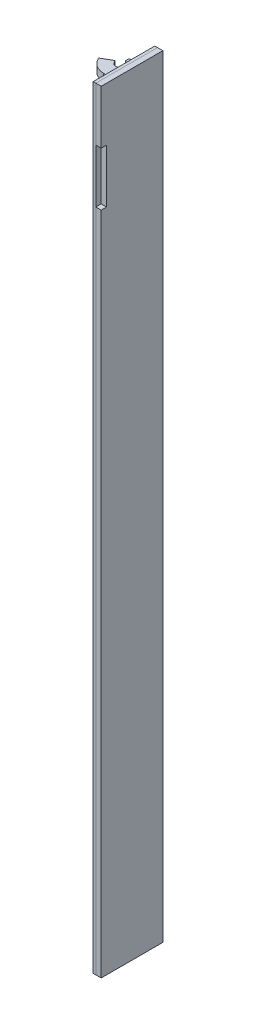
from build123d import *

# Parameters (mm, degrees)
SKETCH1_W             = 288
SKETCH1_H             = 23
BOSS_EXTRUDE1_DEPTH   = 1
BOSS_EXTRUDE5_START   = 1
SKETCH1_2_W           = 288
SKETCH1_2_H           = 23
BOSS_EXTRUDE5_DEPTH   = 2
BOSS_EXTRUDE2_DEPTH   = 2.8
BOSS_EXTRUDE3_START   = -270.5
BOSS_EXTRUDE3_DEPTH   = 2.8
CUT_EXTRUDE1_START    = -2
CUT_EXTRUDE1_DEPTH    = 1
BOSS_EXTRUDE4_START   = -2
BOSS_EXTRUDE4_DEPTH   = 1
BOSS_EXTRUDE4_2_DEPTH = 1
BOSS_EXTRUDE4_3_DEPTH = 1
BOSS_EXTRUDE4_4_DEPTH = 1
BOSS_EXTRUDE4_5_DEPTH = 1
BOSS_EXTRUDE4_6_DEPTH = 1
BOSS_EXTRUDE4_7_DEPTH = 1
BOSS_EXTRUDE4_8_DEPTH = 1
SKETCH6_W             = 20
SKETCH6_H             = 2
CUT_EXTRUDE2_DEPTH    = 2


with BuildPart() as part:
    # Sketch1 → Boss-Extrude1 (new body)
    with BuildSketch(Plane.YZ):
        Rectangle(SKETCH1_W, SKETCH1_H)
    extrude(amount=BOSS_EXTRUDE1_DEPTH)

    # Sketch3 → Boss-Extrude2 (add)
    with BuildSketch(Plane(origin=(0, 136.65, 0), x_dir=(0, 0, -1), z_dir=(0, 1, 0))):
        with BuildLine():
            Line((8.734313483, 8.05), (9.75, 8.05))
            ThreePointArc((9.75, 8.05), (9.926776695, 7.976776695), (10, 7.8))
            Line((10, 7.8), (10, 1.707106781))
            ThreePointArc((10, 1.707106781), (10.038060234, 1.515765065), (10.146446609, 1.353553391))
            Line((10.146446609, 1.353553391), (11.5, 0))
            Line((11.5, 0), (0.5, 0))
            Line((0.5, 0), (0.5, 4.56))
            ThreePointArc((0.5, 4.56), (0.458994949, 4.658994949), (0.36, 4.7))
            Line((0.36, 4.7), (0.14, 4.7))
            ThreePointArc((0.14, 4.7), (0.041005051, 4.741005051), (0, 4.84))
            Line((0, 4.84), (0, 7.56))
            ThreePointArc((0, 7.56), (0.041005051, 7.658994949), (0.14, 7.7))
            Line((0.14, 7.7), (0.36, 7.7))
            ThreePointArc((0.36, 7.7), (0.458994949, 7.741005051), (0.5, 7.84))
            Line((0.5, 7.84), (0.5, 8.05))
            ThreePointArc((0.5, 8.05), (1.337341226, 11.175), (3.625, 13.462658774))
            Line((3.625, 13.462658774), (4.274519053, 13.837658774))
            ThreePointArc((4.274519053, 13.837658774), (4.464223814, 13.862633879), (4.616025404, 13.746152423))
            Line((4.616025404, 13.746152423), (6.616025404, 10.282050808))
            ThreePointArc((6.616025404, 10.282050808), (6.641000509, 10.092346046), (6.524519053, 9.940544457))
            Line((6.524519053, 9.940544457), (5.875, 9.565544457))
            ThreePointArc((5.875, 9.565544457), (5.78180959, 6.592225213), (8.486274298, 7.83125))
            ThreePointArc((8.486274298, 7.83125), (8.568954026, 7.9875), (8.734313483, 8.05))
        make_face()
    extrude(amount=-BOSS_EXTRUDE2_DEPTH)

    # Sketch3<2> → Boss-Extrude3 (add)
    with BuildSketch(Plane(origin=(0, 136.65, 0), x_dir=(0, 0, -1), z_dir=(0, 1, 0)).offset(BOSS_EXTRUDE3_START)):
        with BuildLine():
            Line((8.734313483, 8.05), (9.75, 8.05))
            ThreePointArc((9.75, 8.05), (9.926776695, 7.976776695), (10, 7.8))
            Line((10, 7.8), (10, 1.707106781))
            ThreePointArc((10, 1.707106781), (10.038060234, 1.515765065), (10.146446609, 1.353553391))
            Line((10.146446609, 1.353553391), (11.5, 0))
            Line((11.5, 0), (0.5, 0))
            Line((0.5, 0), (0.5, 4.56))
            ThreePointArc((0.5, 4.56), (0.458994949, 4.658994949), (0.36, 4.7))
            Line((0.36, 4.7), (0.14, 4.7))
            ThreePointArc((0.14, 4.7), (0.041005051, 4.741005051), (0, 4.84))
            Line((0, 4.84), (0, 7.56))
            ThreePointArc((0, 7.56), (0.041005051, 7.658994949), (0.14, 7.7))
            Line((0.14, 7.7), (0.36, 7.7))
            ThreePointArc((0.36, 7.7), (0.458994949, 7.741005051), (0.5, 7.84))
            Line((0.5, 7.84), (0.5, 8.05))
            ThreePointArc((0.5, 8.05), (1.337341226, 11.175), (3.625, 13.462658774))
            Line((3.625, 13.462658774), (4.274519053, 13.837658774))
            ThreePointArc((4.274519053, 13.837658774), (4.464223814, 13.862633879), (4.616025404, 13.746152423))
            Line((4.616025404, 13.746152423), (6.616025404, 10.282050808))
            ThreePointArc((6.616025404, 10.282050808), (6.641000509, 10.092346046), (6.524519053, 9.940544457))
            Line((6.524519053, 9.940544457), (5.875, 9.565544457))
            ThreePointArc((5.875, 9.565544457), (5.78180959, 6.592225213), (8.486274298, 7.83125))
            ThreePointArc((8.486274298, 7.83125), (8.568954026, 7.9875), (8.734313483, 8.05))
        make_face()
    extrude(amount=-BOSS_EXTRUDE3_DEPTH)


with BuildPart() as body_2:
    # Sketch1<2> → Boss-Extrude5 (new body)
    with BuildSketch(Plane.YZ.offset(BOSS_EXTRUDE5_START)):
        Rectangle(SKETCH1_2_W, SKETCH1_2_H)
    extrude(amount=BOSS_EXTRUDE5_DEPTH)

    # Sketch4 → Cut-Extrude1 (cut)
    # profile 1 of 8: a face of its own
    with BuildSketch(Plane.YZ.offset(3).offset(CUT_EXTRUDE1_START)):
        Polygon((105.894557407, 6.823226802), (108.394557407, 4.323226802), (110.894557407, 6.823226802), align=None)
    # profile 2 of 8: a face of its own
    with BuildSketch(Plane.YZ.offset(3).offset(CUT_EXTRUDE1_START)):
        Polygon((-30, -5), (-29, -5), (-29, -0.5), (-10, -0.5), (-10, 5), (-30, 5), (-30, 4), (-11, 4), (-11, 0.5), (-30, 0.5), align=None)
    # profile 3 of 8: a face of its own
    with BuildSketch(Plane.YZ.offset(3).offset(CUT_EXTRUDE1_START)):
        Polygon((10, 5), (10, 4), (0.5, 4), (0.5, -5), (-10, -5), (-10, -4), (-0.5, -4), (-0.5, 5), align=None)
    # profile 4 of 8: a face of its own
    with BuildSketch(Plane.YZ.offset(3).offset(CUT_EXTRUDE1_START)):
        Polygon((29.945625464, 5), (32, 5), (23.027187268, 0), (32, -5), (29.945625464, -5), (22, -0.572388669), (14.054374536, -5), (12, -5), (20.972812732, 0), (12, 5), (14.054374536, 5), (22, 0.572388669), align=None)
    # profile 5 of 8: a face of its own
    with BuildSketch(Plane.YZ.offset(3).offset(CUT_EXTRUDE1_START)):
        with BuildLine():
            add(Edge.make_bspline(
                [(112.554813818, 5.558202763), (112.554990732, 5.589096731), (112.55533817, 5.649768497), (112.561358461, 5.738776255), (112.569293673, 5.824093515), (112.582216154, 5.905384691), (112.597417709, 5.983030256), (112.61643082, 6.05700716), (112.639334885, 6.127055969), (112.657555251, 6.171781377), (112.666492503, 6.19371959)],
                knots=[0, 0, 0, 0, 1.141009212, 2.240794809, 3.294380675, 4.305229195, 5.280013876, 6.216333343, 7.125095522, 8, 8, 8, 8], degree=3))
            add(Edge.make_bspline(
                [(112.666492503, 6.19371959), (112.68110152, 6.224907301), (112.710147726, 6.286915905), (112.764091096, 6.374539047), (112.825232726, 6.45717477), (112.893069253, 6.534389863), (112.965868789, 6.605021896), (113.043974769, 6.665472746), (113.124612321, 6.717783967), (113.181963928, 6.744093402), (113.210362696, 6.757121032)],
                knots=[0, 0, 0, 0, 1.031372299, 2.050613973, 3.077158538, 4.108712802, 5.127684358, 6.111366908, 7.06480644, 8, 8, 8, 8], degree=3))
            add(Edge.make_bspline(
                [(113.210362696, 6.757121032), (113.229639673, 6.765028018), (113.268603359, 6.781010053), (113.329157514, 6.80095647), (113.392009265, 6.817162032), (113.456704009, 6.831647916), (113.523869878, 6.84163641), (113.592964144, 6.850011419), (113.664364936, 6.854400907), (113.712661337, 6.854982511), (113.737205644, 6.855278084)],
                knots=[0, 0, 0, 0, 0.92659354, 1.872881803, 2.832850937, 3.813025581, 4.820167273, 5.851730198, 6.908245912, 8, 8, 8, 8], degree=3))
            add(Edge.make_bspline(
                [(113.737205644, 6.855278084), (113.781154127, 6.854176439), (113.867161911, 6.852020507), (113.992795131, 6.836448461), (114.111682302, 6.810153628), (114.22342099, 6.772147848), (114.32897457, 6.724639799), (114.427522955, 6.665711474), (114.519211997, 6.596000657), (114.603864605, 6.516463308), (114.680100341, 6.427238041), (114.746495334, 6.329158352), (114.802191757, 6.222683852), (114.848060977, 6.108108309), (114.883308016, 5.985057484), (114.908773969, 5.853878576), (114.923902807, 5.714474961), (114.925690551, 5.618837906), (114.926608689, 5.569721193)],
                knots=[0, 0, 0, 0, 1.064641025, 2.083517118, 3.061799897, 4.009540929, 4.938075217, 5.861300345, 6.78508344, 7.723570974, 8.670267188, 9.622657076, 10.586935816, 11.576069104, 12.607749008, 13.683335114, 14.81022093, 16, 16, 16, 16], degree=3))
            add(Edge.make_bspline(
                [(114.926608689, 5.569721193), (114.925711757, 5.520933371), (114.923965597, 5.425952598), (114.90855437, 5.287642889), (114.884144198, 5.157420279), (114.848044321, 5.035582243), (114.803544104, 4.921199076), (114.747274551, 4.815633172), (114.68227007, 4.71748427), (114.606142612, 4.629220475), (114.522914756, 4.549226661), (114.431342017, 4.480330588), (114.333511016, 4.421322418), (114.228532933, 4.373677078), (114.117091997, 4.336454014), (113.998824527, 4.309957124), (113.873669866, 4.294445002), (113.787997195, 4.292281241), (113.744216862, 4.291175519)],
                knots=[0, 0, 0, 0, 1.18845052, 2.313691126, 3.386664782, 4.412527756, 5.405809582, 6.372003093, 7.321919452, 8.268293321, 9.206237639, 10.129603466, 11.054616372, 11.9847576, 12.932764752, 13.912672021, 14.933336461, 16, 16, 16, 16], degree=3))
            add(Edge.make_bspline(
                [(113.744216862, 4.291175519), (113.699936443, 4.292283793), (113.613266942, 4.294453003), (113.48677739, 4.309917908), (113.367335914, 4.336423519), (113.255027566, 4.373777516), (113.149086384, 4.420699065), (113.05049048, 4.479104257), (112.959185354, 4.548436661), (112.875262081, 4.627488878), (112.799181696, 4.715493176), (112.734269512, 4.813011008), (112.677997024, 4.917545797), (112.633262848, 5.030680993), (112.59736176, 5.151252582), (112.572891939, 5.279954341), (112.557450912, 5.416432049), (112.555708916, 5.510082095), (112.554813818, 5.558202763)],
                knots=[0, 0, 0, 0, 1.080878253, 2.11558926, 3.1052859, 4.062802436, 5.000434901, 5.928596448, 6.853693179, 7.793554778, 8.738606028, 9.68692032, 10.647726704, 11.63151566, 12.651483354, 13.714466703, 14.825613081, 16, 16, 16, 16], degree=3))
        make_face()
        with BuildLine():
            add(Edge.make_bspline(
                [(113.035583048, 5.574729205), (113.036063331, 5.540147601), (113.036993389, 5.473180981), (113.046899736, 5.375980553), (113.061933415, 5.285111785), (113.084042648, 5.200677811), (113.111973456, 5.122617548), (113.146194486, 5.0508657), (113.186564315, 4.985315401), (113.234127113, 4.927350509), (113.285586331, 4.875599034), (113.341131965, 4.830820956), (113.399728842, 4.792280191), (113.462390863, 4.761852387), (113.527813922, 4.737704596), (113.596506309, 4.719799893), (113.668809579, 4.709968453), (113.718147323, 4.708558544), (113.74321526, 4.707842186)],
                knots=[0, 0, 0, 0, 1.313550922, 2.543666373, 3.708465049, 4.810029406, 5.85539231, 6.85404609, 7.825601258, 8.772642133, 9.696587791, 10.59409323, 11.479048685, 12.35559886, 13.234601248, 14.125357077, 15.047515647, 16, 16, 16, 16], degree=3))
            add(Edge.make_bspline(
                [(113.74321526, 4.707842186), (113.768286573, 4.70854403), (113.817630965, 4.709925372), (113.889845396, 4.719957829), (113.958673913, 4.737095098), (114.023837065, 4.761119146), (114.085631857, 4.792030106), (114.144004465, 4.829706868), (114.198618415, 4.874688667), (114.25002162, 4.925688322), (114.296300583, 4.984038211), (114.336326697, 5.049577198), (114.370530866, 5.121764223), (114.398464615, 5.20062629), (114.420029736, 5.286311777), (114.434449853, 5.378866021), (114.444436308, 5.478024381), (114.445362572, 5.546490653), (114.445839459, 5.581740423)],
                knots=[0, 0, 0, 0, 0.949153107, 1.868086493, 2.754172764, 3.630100905, 4.492260106, 5.365378617, 6.254840125, 7.166615376, 8.102436631, 9.067266169, 10.06813181, 11.121736829, 12.23011542, 13.408501285, 14.665770308, 16, 16, 16, 16], degree=3))
            add(Edge.make_bspline(
                [(114.445839459, 5.581740423), (114.44530081, 5.616649838), (114.444257665, 5.684255236), (114.435172951, 5.782161815), (114.420293868, 5.87324887), (114.399610299, 5.957492804), (114.372275663, 6.034907192), (114.339627639, 6.105703732), (114.300151541, 6.169512551), (114.254877294, 6.226300609), (114.204779255, 6.276285049), (114.150708572, 6.320044285), (114.092358036, 6.35645463), (114.030297137, 6.387088995), (113.963879758, 6.409816518), (113.893780854, 6.426393783), (113.819802051, 6.436602087), (113.769122873, 6.437931705), (113.74321526, 6.438611417)],
                knots=[0, 0, 0, 0, 1.332337092, 2.580197383, 3.749299508, 4.852775005, 5.886662144, 6.878700295, 7.822989687, 8.743523536, 9.644687758, 10.519443927, 11.392806431, 12.264866173, 13.155606721, 14.065961015, 15.011303331, 16, 16, 16, 16], degree=3))
            add(Edge.make_bspline(
                [(113.74321526, 6.438611417), (113.717304372, 6.437942161), (113.666618789, 6.436632995), (113.592524669, 6.426255677), (113.522204931, 6.410172373), (113.45579694, 6.386147105), (113.393195471, 6.355806927), (113.334632071, 6.318179059), (113.279645279, 6.274494086), (113.229098375, 6.223751767), (113.183090543, 6.166466423), (113.143595434, 6.101877926), (113.109917177, 6.030691662), (113.08228612, 5.952696913), (113.061802962, 5.867679121), (113.04605995, 5.776209658), (113.037219258, 5.677734895), (113.036140174, 5.609802391), (113.035583048, 5.574729205)],
                knots=[0, 0, 0, 0, 0.981996942, 1.920933313, 2.83127778, 3.712125466, 4.592427284, 5.463259035, 6.34592384, 7.249932058, 8.173122297, 9.125107726, 10.113123258, 11.154048744, 12.256187849, 13.424658091, 14.670364834, 16, 16, 16, 16], degree=3))
        make_face(mode=Mode.SUBTRACT)
    # profile 6 of 8: a face of its own
    with BuildSketch(Plane.YZ.offset(3).offset(CUT_EXTRUDE1_START)):
        with BuildLine():
            Line((115.343275356, 4.323226802), (115.343275356, 6.823226802))
            Line((115.343275356, 6.823226802), (116.143055003, 6.823226802))
            add(Edge.make_bspline(
                [(116.143055003, 6.823226802), (116.179280814, 6.823187241), (116.248566982, 6.823111577), (116.34739951, 6.821009321), (116.436383396, 6.818033345), (116.515386571, 6.814326893), (116.584687028, 6.808796155), (116.643973893, 6.802391643), (116.693620491, 6.795502088), (116.722855902, 6.78837232), (116.736003721, 6.785165904)],
                knots=[0, 0, 0, 0, 1.460485487, 2.793352117, 3.985295279, 5.050041172, 5.981765236, 6.787433016, 7.454681457, 8, 8, 8, 8], degree=3))
            add(Edge.make_bspline(
                [(116.736003721, 6.785165904), (116.753487124, 6.780180712), (116.788187582, 6.770286275), (116.837902517, 6.749192905), (116.885819842, 6.724746815), (116.931337528, 6.695611494), (116.974610302, 6.662304198), (117.015766792, 6.625096551), (117.055026479, 6.583820591), (117.091846256, 6.538557856), (117.12556884, 6.489536583), (117.154713625, 6.436684297), (117.179130862, 6.38023072), (117.199933942, 6.320600094), (117.215282553, 6.257153081), (117.226023791, 6.19033052), (117.233501032, 6.120103182), (117.234030444, 6.07204532), (117.234300997, 6.047485616)],
                knots=[0, 0, 0, 0, 0.907145743, 1.80047177, 2.69161667, 3.591261238, 4.495029544, 5.415863088, 6.359363025, 7.337192411, 8.326890979, 9.326929023, 10.346104993, 11.395420813, 12.477187422, 13.601053412, 14.774031606, 16, 16, 16, 16], degree=3))
            add(Edge.make_bspline(
                [(117.234300997, 6.047485616), (117.233529381, 6.010188912), (117.232043979, 5.938390709), (117.215424958, 5.835459283), (117.190076864, 5.74143806), (117.153028793, 5.657232661), (117.107859498, 5.58251265), (117.05810459, 5.515152912), (117.001291797, 5.45718374), (116.939910585, 5.407669616), (116.875041863, 5.367149311), (116.810055715, 5.332606326), (116.744075248, 5.306048576), (116.699089913, 5.294477151), (116.67690917, 5.288771673)],
                knots=[0, 0, 0, 0, 1.312386234, 2.526415563, 3.661883817, 4.733421185, 5.753802465, 6.732107337, 7.675884281, 8.604170108, 9.50284679, 10.365392406, 11.194030444, 12, 12, 12, 12], degree=3))
            add(Edge.make_bspline(
                [(116.67690917, 5.288771673), (116.661077644, 5.285760145), (116.627706675, 5.279412202), (116.574782315, 5.273084459), (116.516933121, 5.266080337), (116.453921156, 5.261511855), (116.385822647, 5.257233664), (116.312664038, 5.255213788), (116.23454988, 5.252780248), (116.180784444, 5.25273652), (116.153071029, 5.252713981)],
                knots=[0, 0, 0, 0, 0.735353946, 1.55003838, 2.431865514, 3.394945452, 4.432993119, 5.54609699, 6.735134699, 8, 8, 8, 8], degree=3))
            Line((116.153071029, 5.252713981), (115.824044587, 5.252713981))
            Line((115.824044587, 5.252713981), (115.824044587, 4.323226802))
            Line((115.824044587, 4.323226802), (115.343275356, 4.323226802))
        make_face()
        with BuildLine():
            Line((115.824044587, 6.406560135), (115.824044587, 5.669380648))
            Line((115.824044587, 5.669380648), (116.112506125, 5.669380648))
            add(Edge.make_bspline(
                [(116.112506125, 5.669380648), (116.13738144, 5.669412859), (116.184971048, 5.669474484), (116.253251578, 5.671686443), (116.315059178, 5.674386549), (116.370522994, 5.678855777), (116.419308231, 5.684746113), (116.461741591, 5.691791696), (116.497872531, 5.699352344), (116.536943223, 5.711881548), (116.578717605, 5.732152657), (116.623327735, 5.761287334), (116.662517681, 5.796121275), (116.695128911, 5.837032533), (116.721178064, 5.882487311), (116.739829276, 5.932019773), (116.751872347, 5.984808994), (116.752972371, 6.021377456), (116.753531766, 6.039973596)],
                knots=[0, 0, 0, 0, 1.411705958, 2.700771114, 3.876961699, 4.922619712, 5.858038221, 6.66485904, 7.363650596, 7.950905807, 8.989198271, 9.987739806, 10.967313358, 11.951275539, 12.944273208, 13.927870418, 14.946261014, 16, 16, 16, 16], degree=3))
            add(Edge.make_bspline(
                [(116.753531766, 6.039973596), (116.752744479, 6.062623406), (116.751218033, 6.106538399), (116.734385597, 6.169080679), (116.708415071, 6.225838556), (116.671284592, 6.275046037), (116.626431847, 6.316425482), (116.576019233, 6.350854651), (116.518970167, 6.374948446), (116.47859472, 6.384283902), (116.45805901, 6.38903209)],
                knots=[0, 0, 0, 0, 1.085904563, 2.105425768, 3.088705091, 4.068969419, 5.045188284, 6.010769642, 6.988240112, 8, 8, 8, 8], degree=3))
            add(Edge.make_bspline(
                [(116.45805901, 6.38903209), (116.449222025, 6.390445494), (116.429606657, 6.393582812), (116.397001924, 6.396856993), (116.358430521, 6.399834858), (116.313845951, 6.402279774), (116.263424939, 6.404191132), (116.207001173, 6.405865954), (116.144723254, 6.406000503), (116.101154222, 6.406368423), (116.078451638, 6.406560135)],
                knots=[0, 0, 0, 0, 0.564603001, 1.253243608, 2.066786758, 3.005752288, 4.070476343, 5.250658742, 6.567396469, 8, 8, 8, 8], degree=3))
            Line((116.078451638, 6.406560135), (115.824044587, 6.406560135))
        make_face(mode=Mode.SUBTRACT)
    # profile 7 of 8: a face of its own
    with BuildSketch(Plane.YZ.offset(3).offset(CUT_EXTRUDE1_START)):
        Polygon((117.650967664, 4.323226802), (117.650967664, 6.823226802), (119.509942023, 6.823226802), (119.509942023, 6.406560135), (118.131736894, 6.406560135), (118.131736894, 5.86168834), (119.413788176, 5.86168834), (119.413788176, 5.445021673), (118.131736894, 5.445021673), (118.131736894, 4.739893468), (119.541993305, 4.739893468), (119.541993305, 4.323226802), align=None)
    # profile 8 of 8: a face of its own
    with BuildSketch(Plane.YZ.offset(3).offset(CUT_EXTRUDE1_START)):
        Polygon((119.958659971, 4.323226802), (119.958659971, 6.823226802), (120.460963657, 6.823226802), (121.465070228, 5.179596994), (121.465070228, 6.823226802), (121.945839459, 6.823226802), (121.945839459, 4.323226802), (121.428010933, 4.323226802), (120.439429202, 5.940814943), (120.439429202, 4.323226802), align=None)
    extrude(amount=CUT_EXTRUDE1_DEPTH, mode=Mode.SUBTRACT)

    # Sketch6 → Cut-Extrude2 (cut)
    with BuildSketch(Plane.YZ.offset(3)):
        with Locations((114, 10.5)):
            Rectangle(SKETCH6_W, SKETCH6_H)
    extrude(amount=-CUT_EXTRUDE2_DEPTH, mode=Mode.SUBTRACT)


with BuildPart() as body_3:
    # Sketch4<2> → Boss-Extrude4 (new body)
    with BuildSketch(Plane.YZ.offset(3).offset(BOSS_EXTRUDE4_START)):
        Polygon((110.894557407, 6.823226802), (105.894557407, 6.823226802), (108.394557407, 4.323226802), align=None)
    extrude(amount=BOSS_EXTRUDE4_DEPTH)


with BuildPart() as body_4:
    # Sketch4<2> → Boss-Extrude4 2 (new body)
    with BuildSketch(Plane.YZ.offset(3).offset(BOSS_EXTRUDE4_START)):
        Polygon((-30, 0.5), (-30, -5), (-29, -5), (-29, -0.5), (-10, -0.5), (-10, 5), (-30, 5), (-30, 4), (-11, 4), (-11, 0.5), align=None)
    extrude(amount=BOSS_EXTRUDE4_2_DEPTH)


with BuildPart() as body_5:
    # Sketch4<2> → Boss-Extrude4 3 (new body)
    with BuildSketch(Plane.YZ.offset(3).offset(BOSS_EXTRUDE4_START)):
        Polygon((10, 4), (10, 5), (-0.5, 5), (-0.5, -4), (-10, -4), (-10, -5), (0.5, -5), (0.5, 4), align=None)
    extrude(amount=BOSS_EXTRUDE4_3_DEPTH)


with BuildPart() as body_6:
    # Sketch4<2> → Boss-Extrude4 4 (new body)
    with BuildSketch(Plane.YZ.offset(3).offset(BOSS_EXTRUDE4_START)):
        Polygon((32, 5), (29.945625464, 5), (22, 0.572388669), (14.054374536, 5), (12, 5), (20.972812732, 0), (12, -5), (14.054374536, -5), (22, -0.572388669), (29.945625464, -5), (32, -5), (23.027187268, 0), align=None)
    extrude(amount=BOSS_EXTRUDE4_4_DEPTH)


with BuildPart() as body_7:
    # Sketch4<2> → Boss-Extrude4 5 (new body)
    with BuildSketch(Plane.YZ.offset(3).offset(BOSS_EXTRUDE4_START)):
        with BuildLine():
            add(Edge.make_bspline(
                [(112.554813818, 5.558202763), (112.554990732, 5.589096731), (112.55533817, 5.649768497), (112.561358461, 5.738776255), (112.569293673, 5.824093515), (112.582216154, 5.905384691), (112.597417709, 5.983030256), (112.61643082, 6.05700716), (112.639334885, 6.127055969), (112.657555251, 6.171781377), (112.666492503, 6.19371959)],
                knots=[0, 0, 0, 0, 1.141009212, 2.240794809, 3.294380675, 4.305229195, 5.280013876, 6.216333343, 7.125095522, 8, 8, 8, 8], degree=3))
            add(Edge.make_bspline(
                [(113.744216862, 4.291175519), (113.699936443, 4.292283793), (113.613266942, 4.294453003), (113.48677739, 4.309917908), (113.367335914, 4.336423519), (113.255027566, 4.373777516), (113.149086384, 4.420699065), (113.05049048, 4.479104257), (112.959185354, 4.548436661), (112.875262081, 4.627488878), (112.799181696, 4.715493176), (112.734269512, 4.813011008), (112.677997024, 4.917545797), (112.633262848, 5.030680993), (112.59736176, 5.151252582), (112.572891939, 5.279954341), (112.557450912, 5.416432049), (112.555708916, 5.510082095), (112.554813818, 5.558202763)],
                knots=[0, 0, 0, 0, 1.080878253, 2.11558926, 3.1052859, 4.062802436, 5.000434901, 5.928596448, 6.853693179, 7.793554778, 8.738606028, 9.68692032, 10.647726704, 11.63151566, 12.651483354, 13.714466703, 14.825613081, 16, 16, 16, 16], degree=3))
            add(Edge.make_bspline(
                [(114.926608689, 5.569721193), (114.925711757, 5.520933371), (114.923965597, 5.425952598), (114.90855437, 5.287642889), (114.884144198, 5.157420279), (114.848044321, 5.035582243), (114.803544104, 4.921199076), (114.747274551, 4.815633172), (114.68227007, 4.71748427), (114.606142612, 4.629220475), (114.522914756, 4.549226661), (114.431342017, 4.480330588), (114.333511016, 4.421322418), (114.228532933, 4.373677078), (114.117091997, 4.336454014), (113.998824527, 4.309957124), (113.873669866, 4.294445002), (113.787997195, 4.292281241), (113.744216862, 4.291175519)],
                knots=[0, 0, 0, 0, 1.18845052, 2.313691126, 3.386664782, 4.412527756, 5.405809582, 6.372003093, 7.321919452, 8.268293321, 9.206237639, 10.129603466, 11.054616372, 11.9847576, 12.932764752, 13.912672021, 14.933336461, 16, 16, 16, 16], degree=3))
            add(Edge.make_bspline(
                [(113.737205644, 6.855278084), (113.781154127, 6.854176439), (113.867161911, 6.852020507), (113.992795131, 6.836448461), (114.111682302, 6.810153628), (114.22342099, 6.772147848), (114.32897457, 6.724639799), (114.427522955, 6.665711474), (114.519211997, 6.596000657), (114.603864605, 6.516463308), (114.680100341, 6.427238041), (114.746495334, 6.329158352), (114.802191757, 6.222683852), (114.848060977, 6.108108309), (114.883308016, 5.985057484), (114.908773969, 5.853878576), (114.923902807, 5.714474961), (114.925690551, 5.618837906), (114.926608689, 5.569721193)],
                knots=[0, 0, 0, 0, 1.064641025, 2.083517118, 3.061799897, 4.009540929, 4.938075217, 5.861300345, 6.78508344, 7.723570974, 8.670267188, 9.622657076, 10.586935816, 11.576069104, 12.607749008, 13.683335114, 14.81022093, 16, 16, 16, 16], degree=3))
            add(Edge.make_bspline(
                [(113.210362696, 6.757121032), (113.229639673, 6.765028018), (113.268603359, 6.781010053), (113.329157514, 6.80095647), (113.392009265, 6.817162032), (113.456704009, 6.831647916), (113.523869878, 6.84163641), (113.592964144, 6.850011419), (113.664364936, 6.854400907), (113.712661337, 6.854982511), (113.737205644, 6.855278084)],
                knots=[0, 0, 0, 0, 0.92659354, 1.872881803, 2.832850937, 3.813025581, 4.820167273, 5.851730198, 6.908245912, 8, 8, 8, 8], degree=3))
            add(Edge.make_bspline(
                [(112.666492503, 6.19371959), (112.68110152, 6.224907301), (112.710147726, 6.286915905), (112.764091096, 6.374539047), (112.825232726, 6.45717477), (112.893069253, 6.534389863), (112.965868789, 6.605021896), (113.043974769, 6.665472746), (113.124612321, 6.717783967), (113.181963928, 6.744093402), (113.210362696, 6.757121032)],
                knots=[0, 0, 0, 0, 1.031372299, 2.050613973, 3.077158538, 4.108712802, 5.127684358, 6.111366908, 7.06480644, 8, 8, 8, 8], degree=3))
        make_face()
        with BuildLine():
            add(Edge.make_bspline(
                [(113.035583048, 5.574729205), (113.036063331, 5.540147601), (113.036993389, 5.473180981), (113.046899736, 5.375980553), (113.061933415, 5.285111785), (113.084042648, 5.200677811), (113.111973456, 5.122617548), (113.146194486, 5.0508657), (113.186564315, 4.985315401), (113.234127113, 4.927350509), (113.285586331, 4.875599034), (113.341131965, 4.830820956), (113.399728842, 4.792280191), (113.462390863, 4.761852387), (113.527813922, 4.737704596), (113.596506309, 4.719799893), (113.668809579, 4.709968453), (113.718147323, 4.708558544), (113.74321526, 4.707842186)],
                knots=[0, 0, 0, 0, 1.313550922, 2.543666373, 3.708465049, 4.810029406, 5.85539231, 6.85404609, 7.825601258, 8.772642133, 9.696587791, 10.59409323, 11.479048685, 12.35559886, 13.234601248, 14.125357077, 15.047515647, 16, 16, 16, 16], degree=3))
            add(Edge.make_bspline(
                [(113.74321526, 6.438611417), (113.717304372, 6.437942161), (113.666618789, 6.436632995), (113.592524669, 6.426255677), (113.522204931, 6.410172373), (113.45579694, 6.386147105), (113.393195471, 6.355806927), (113.334632071, 6.318179059), (113.279645279, 6.274494086), (113.229098375, 6.223751767), (113.183090543, 6.166466423), (113.143595434, 6.101877926), (113.109917177, 6.030691662), (113.08228612, 5.952696913), (113.061802962, 5.867679121), (113.04605995, 5.776209658), (113.037219258, 5.677734895), (113.036140174, 5.609802391), (113.035583048, 5.574729205)],
                knots=[0, 0, 0, 0, 0.981996942, 1.920933313, 2.83127778, 3.712125466, 4.592427284, 5.463259035, 6.34592384, 7.249932058, 8.173122297, 9.125107726, 10.113123258, 11.154048744, 12.256187849, 13.424658091, 14.670364834, 16, 16, 16, 16], degree=3))
            add(Edge.make_bspline(
                [(114.445839459, 5.581740423), (114.44530081, 5.616649838), (114.444257665, 5.684255236), (114.435172951, 5.782161815), (114.420293868, 5.87324887), (114.399610299, 5.957492804), (114.372275663, 6.034907192), (114.339627639, 6.105703732), (114.300151541, 6.169512551), (114.254877294, 6.226300609), (114.204779255, 6.276285049), (114.150708572, 6.320044285), (114.092358036, 6.35645463), (114.030297137, 6.387088995), (113.963879758, 6.409816518), (113.893780854, 6.426393783), (113.819802051, 6.436602087), (113.769122873, 6.437931705), (113.74321526, 6.438611417)],
                knots=[0, 0, 0, 0, 1.332337092, 2.580197383, 3.749299508, 4.852775005, 5.886662144, 6.878700295, 7.822989687, 8.743523536, 9.644687758, 10.519443927, 11.392806431, 12.264866173, 13.155606721, 14.065961015, 15.011303331, 16, 16, 16, 16], degree=3))
            add(Edge.make_bspline(
                [(113.74321526, 4.707842186), (113.768286573, 4.70854403), (113.817630965, 4.709925372), (113.889845396, 4.719957829), (113.958673913, 4.737095098), (114.023837065, 4.761119146), (114.085631857, 4.792030106), (114.144004465, 4.829706868), (114.198618415, 4.874688667), (114.25002162, 4.925688322), (114.296300583, 4.984038211), (114.336326697, 5.049577198), (114.370530866, 5.121764223), (114.398464615, 5.20062629), (114.420029736, 5.286311777), (114.434449853, 5.378866021), (114.444436308, 5.478024381), (114.445362572, 5.546490653), (114.445839459, 5.581740423)],
                knots=[0, 0, 0, 0, 0.949153107, 1.868086493, 2.754172764, 3.630100905, 4.492260106, 5.365378617, 6.254840125, 7.166615376, 8.102436631, 9.067266169, 10.06813181, 11.121736829, 12.23011542, 13.408501285, 14.665770308, 16, 16, 16, 16], degree=3))
        make_face(mode=Mode.SUBTRACT)
    extrude(amount=BOSS_EXTRUDE4_5_DEPTH)


with BuildPart() as body_8:
    # Sketch4<2> → Boss-Extrude4 6 (new body)
    with BuildSketch(Plane.YZ.offset(3).offset(BOSS_EXTRUDE4_START)):
        with BuildLine():
            Line((115.343275356, 6.823226802), (115.343275356, 4.323226802))
            Line((115.343275356, 4.323226802), (115.824044587, 4.323226802))
            Line((115.824044587, 4.323226802), (115.824044587, 5.252713981))
            Line((115.824044587, 5.252713981), (116.153071029, 5.252713981))
            add(Edge.make_bspline(
                [(116.67690917, 5.288771673), (116.661077644, 5.285760145), (116.627706675, 5.279412202), (116.574782315, 5.273084459), (116.516933121, 5.266080337), (116.453921156, 5.261511855), (116.385822647, 5.257233664), (116.312664038, 5.255213788), (116.23454988, 5.252780248), (116.180784444, 5.25273652), (116.153071029, 5.252713981)],
                knots=[0, 0, 0, 0, 0.735353946, 1.55003838, 2.431865514, 3.394945452, 4.432993119, 5.54609699, 6.735134699, 8, 8, 8, 8], degree=3))
            add(Edge.make_bspline(
                [(117.234300997, 6.047485616), (117.233529381, 6.010188912), (117.232043979, 5.938390709), (117.215424958, 5.835459283), (117.190076864, 5.74143806), (117.153028793, 5.657232661), (117.107859498, 5.58251265), (117.05810459, 5.515152912), (117.001291797, 5.45718374), (116.939910585, 5.407669616), (116.875041863, 5.367149311), (116.810055715, 5.332606326), (116.744075248, 5.306048576), (116.699089913, 5.294477151), (116.67690917, 5.288771673)],
                knots=[0, 0, 0, 0, 1.312386234, 2.526415563, 3.661883817, 4.733421185, 5.753802465, 6.732107337, 7.675884281, 8.604170108, 9.50284679, 10.365392406, 11.194030444, 12, 12, 12, 12], degree=3))
            add(Edge.make_bspline(
                [(116.736003721, 6.785165904), (116.753487124, 6.780180712), (116.788187582, 6.770286275), (116.837902517, 6.749192905), (116.885819842, 6.724746815), (116.931337528, 6.695611494), (116.974610302, 6.662304198), (117.015766792, 6.625096551), (117.055026479, 6.583820591), (117.091846256, 6.538557856), (117.12556884, 6.489536583), (117.154713625, 6.436684297), (117.179130862, 6.38023072), (117.199933942, 6.320600094), (117.215282553, 6.257153081), (117.226023791, 6.19033052), (117.233501032, 6.120103182), (117.234030444, 6.07204532), (117.234300997, 6.047485616)],
                knots=[0, 0, 0, 0, 0.907145743, 1.80047177, 2.69161667, 3.591261238, 4.495029544, 5.415863088, 6.359363025, 7.337192411, 8.326890979, 9.326929023, 10.346104993, 11.395420813, 12.477187422, 13.601053412, 14.774031606, 16, 16, 16, 16], degree=3))
            add(Edge.make_bspline(
                [(116.143055003, 6.823226802), (116.179280814, 6.823187241), (116.248566982, 6.823111577), (116.34739951, 6.821009321), (116.436383396, 6.818033345), (116.515386571, 6.814326893), (116.584687028, 6.808796155), (116.643973893, 6.802391643), (116.693620491, 6.795502088), (116.722855902, 6.78837232), (116.736003721, 6.785165904)],
                knots=[0, 0, 0, 0, 1.460485487, 2.793352117, 3.985295279, 5.050041172, 5.981765236, 6.787433016, 7.454681457, 8, 8, 8, 8], degree=3))
            Line((116.143055003, 6.823226802), (115.343275356, 6.823226802))
        make_face()
        with BuildLine():
            Line((115.824044587, 5.669380648), (115.824044587, 6.406560135))
            Line((115.824044587, 6.406560135), (116.078451638, 6.406560135))
            add(Edge.make_bspline(
                [(116.45805901, 6.38903209), (116.449222025, 6.390445494), (116.429606657, 6.393582812), (116.397001924, 6.396856993), (116.358430521, 6.399834858), (116.313845951, 6.402279774), (116.263424939, 6.404191132), (116.207001173, 6.405865954), (116.144723254, 6.406000503), (116.101154222, 6.406368423), (116.078451638, 6.406560135)],
                knots=[0, 0, 0, 0, 0.564603001, 1.253243608, 2.066786758, 3.005752288, 4.070476343, 5.250658742, 6.567396469, 8, 8, 8, 8], degree=3))
            add(Edge.make_bspline(
                [(116.753531766, 6.039973596), (116.752744479, 6.062623406), (116.751218033, 6.106538399), (116.734385597, 6.169080679), (116.708415071, 6.225838556), (116.671284592, 6.275046037), (116.626431847, 6.316425482), (116.576019233, 6.350854651), (116.518970167, 6.374948446), (116.47859472, 6.384283902), (116.45805901, 6.38903209)],
                knots=[0, 0, 0, 0, 1.085904563, 2.105425768, 3.088705091, 4.068969419, 5.045188284, 6.010769642, 6.988240112, 8, 8, 8, 8], degree=3))
            add(Edge.make_bspline(
                [(116.112506125, 5.669380648), (116.13738144, 5.669412859), (116.184971048, 5.669474484), (116.253251578, 5.671686443), (116.315059178, 5.674386549), (116.370522994, 5.678855777), (116.419308231, 5.684746113), (116.461741591, 5.691791696), (116.497872531, 5.699352344), (116.536943223, 5.711881548), (116.578717605, 5.732152657), (116.623327735, 5.761287334), (116.662517681, 5.796121275), (116.695128911, 5.837032533), (116.721178064, 5.882487311), (116.739829276, 5.932019773), (116.751872347, 5.984808994), (116.752972371, 6.021377456), (116.753531766, 6.039973596)],
                knots=[0, 0, 0, 0, 1.411705958, 2.700771114, 3.876961699, 4.922619712, 5.858038221, 6.66485904, 7.363650596, 7.950905807, 8.989198271, 9.987739806, 10.967313358, 11.951275539, 12.944273208, 13.927870418, 14.946261014, 16, 16, 16, 16], degree=3))
            Line((116.112506125, 5.669380648), (115.824044587, 5.669380648))
        make_face(mode=Mode.SUBTRACT)
    extrude(amount=BOSS_EXTRUDE4_6_DEPTH)


with BuildPart() as body_9:
    # Sketch4<2> → Boss-Extrude4 7 (new body)
    with BuildSketch(Plane.YZ.offset(3).offset(BOSS_EXTRUDE4_START)):
        Polygon((117.650967664, 6.823226802), (117.650967664, 4.323226802), (119.541993305, 4.323226802), (119.541993305, 4.739893468), (118.131736894, 4.739893468), (118.131736894, 5.445021673), (119.413788176, 5.445021673), (119.413788176, 5.86168834), (118.131736894, 5.86168834), (118.131736894, 6.406560135), (119.509942023, 6.406560135), (119.509942023, 6.823226802), align=None)
    extrude(amount=BOSS_EXTRUDE4_7_DEPTH)


with BuildPart() as body_10:
    # Sketch4<2> → Boss-Extrude4 8 (new body)
    with BuildSketch(Plane.YZ.offset(3).offset(BOSS_EXTRUDE4_START)):
        Polygon((119.958659971, 6.823226802), (119.958659971, 4.323226802), (120.439429202, 4.323226802), (120.439429202, 5.940814943), (121.428010933, 4.323226802), (121.945839459, 4.323226802), (121.945839459, 6.823226802), (121.465070228, 6.823226802), (121.465070228, 5.179596994), (120.460963657, 6.823226802), align=None)
    extrude(amount=BOSS_EXTRUDE4_8_DEPTH)


solid = Compound([part.part, body_2.part, body_3.part, body_4.part, body_5.part, body_6.part, body_7.part, body_8.part, body_9.part, body_10.part])
